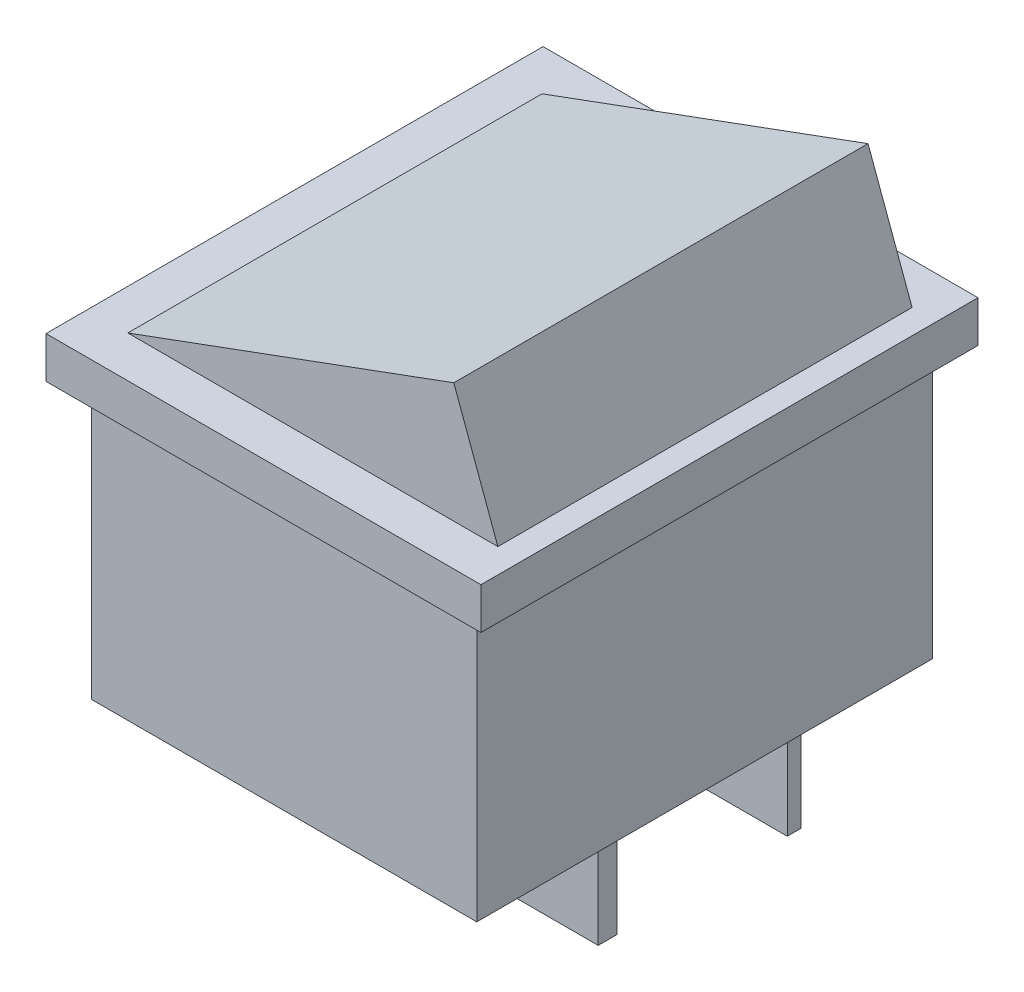
from build123d import *

# Parameters (mm, degrees)
SKETCH1_W           = 21
SKETCH1_H           = 24
BOSS_EXTRUDE1_DEPTH = 2
SKETCH2_W           = 18.6
SKETCH2_H           = 22
BOSS_EXTRUDE2_DEPTH = 13.2
SKETCH3_W           = 4.885548906
SKETCH3_H           = 0.896605201
SKETCH3_H_2         = 0.661547926
SKETCH3_W_2         = 6.515688333
BOSS_EXTRUDE3_DEPTH = 6.3
BOSS_EXTRUDE4_DEPTH = 10


with BuildPart() as part:
    # Sketch1 → Boss-Extrude1 (new body)
    with BuildSketch(Plane(origin=(0, 0, 0), x_dir=(1, 0, 0), z_dir=(0, 1, 0))):
        Rectangle(SKETCH1_W, SKETCH1_H)
    extrude(amount=BOSS_EXTRUDE1_DEPTH)

    # Sketch2 → Boss-Extrude2 (add)
    with BuildSketch(Plane.XZ):
        Rectangle(SKETCH2_W, SKETCH2_H)
    extrude(amount=BOSS_EXTRUDE2_DEPTH)

    # Sketch3 → Boss-Extrude3 (add)
    with BuildSketch(Plane.XZ.offset(13.2)):
        with Locations((4.472159413, 2.304982967)):
            Rectangle(SKETCH3_W, SKETCH3_H)
        with Locations((4.472159413, -6.706929347)):
            Rectangle(SKETCH3_W, SKETCH3_H_2)
        with Locations((-4.244383184, -6.706929347)):
            Rectangle(SKETCH3_W_2, SKETCH3_H_2)
        with Locations((-4.244383184, 2.304982967)):
            Rectangle(SKETCH3_W_2, SKETCH3_H)
    extrude(amount=BOSS_EXTRUDE3_DEPTH)

    # Sketch4 → Boss-Extrude4 (add, symmetric)
    with BuildSketch(Plane.XY):
        Polygon((-8.803379904, 1.907067214), (7.189360766, 7.787523085), (9.380607332, 1.828114693), align=None)
    extrude(amount=BOSS_EXTRUDE4_DEPTH, both=True)


solid = part.part
